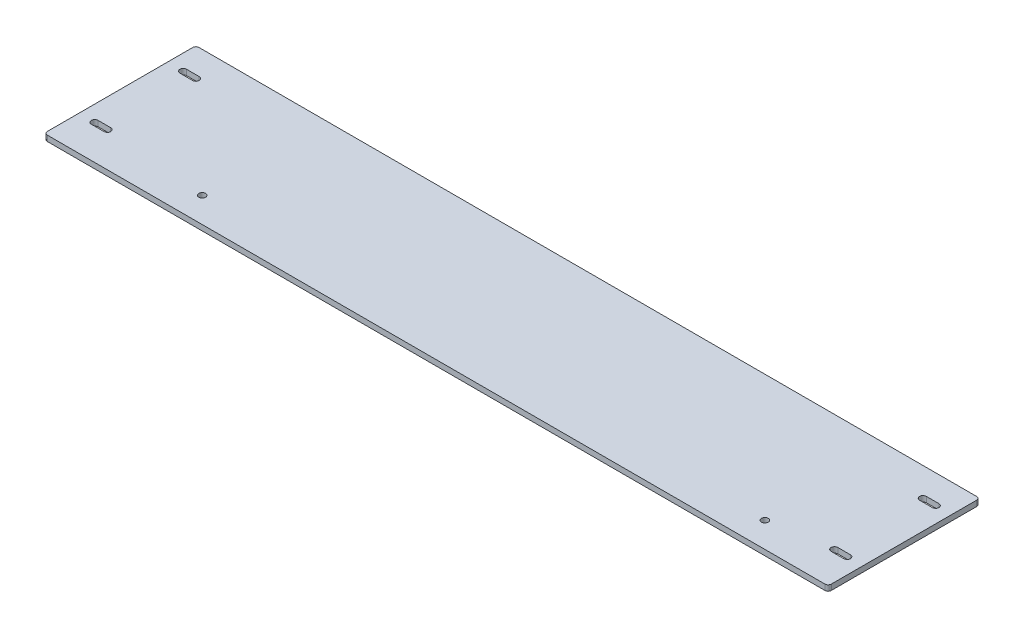
from build123d import *

# Parameters (mm, degrees)
SKETCH1_W           = 787.4
SKETCH1_H           = 152.4
BOSS_EXTRUDE1_DEPTH = 5.588
FILLET1_R           = 3.175
SKETCH2_R           = 3.3782
CUT_EXTRUDE1_DEPTH  = 803.03225979


with BuildPart() as part:
    # Sketch1 → Boss-Extrude1 (new body)
    with BuildSketch(Plane(origin=(0, 0, 0), x_dir=(1, 0, 0), z_dir=(0, 1, 0))):
        with Locations((393.7, 76.2)):
            Rectangle(SKETCH1_W, SKETCH1_H)
        with BuildLine():
            Line((15.875, 38.3032), (28.575, 38.3032))
            ThreePointArc((28.575, 38.3032), (31.9532, 34.925), (28.575, 31.5468))
            Line((28.575, 31.5468), (15.875, 31.5468))
            ThreePointArc((15.875, 31.5468), (12.4968, 34.925), (15.875, 38.3032))
        make_face(mode=Mode.SUBTRACT)
        with BuildLine():
            Line((15.875, 127.2032), (28.575, 127.2032))
            ThreePointArc((28.575, 127.2032), (31.9532, 123.825), (28.575, 120.4468))
            Line((28.575, 120.4468), (15.875, 120.4468))
            ThreePointArc((15.875, 120.4468), (12.4968, 123.825), (15.875, 127.2032))
        make_face(mode=Mode.SUBTRACT)
        with BuildLine():
            Line((771.525, 120.4468), (758.825, 120.4468))
            ThreePointArc((758.825, 120.4468), (755.4468, 123.825), (758.825, 127.2032))
            Line((758.825, 127.2032), (771.525, 127.2032))
            ThreePointArc((771.525, 127.2032), (774.9032, 123.825), (771.525, 120.4468))
        make_face(mode=Mode.SUBTRACT)
        with BuildLine():
            Line((771.525, 31.5468), (758.825, 31.5468))
            ThreePointArc((758.825, 31.5468), (755.4468, 34.925), (758.825, 38.3032))
            Line((758.825, 38.3032), (771.525, 38.3032))
            ThreePointArc((771.525, 38.3032), (774.9032, 34.925), (771.525, 31.5468))
        make_face(mode=Mode.SUBTRACT)
    extrude(amount=BOSS_EXTRUDE1_DEPTH)

    # Fillet1
    fillet1_edges = [part.edges().sort_by_distance(p)[0] for p in [
        (0, 2.794, -152.4),
        (787.4, 2.794, -152.4),
        (787.4, 2.794, 0),
        (0, 2.794, 0),
    ]]
    fillet(fillet1_edges, radius=FILLET1_R)

    # Sketch2 → Cut-Extrude1 (cut, through all)
    with BuildSketch(Plane(origin=(0, 5.588, 0), x_dir=(1, 0, 0), z_dir=(0, 1, 0))):
        with Locations(Location((133.35, 25.4, 0), (0, 0, 270))):
            Circle(SKETCH2_R)
        with Locations(Location((698.5, 25.4, 0), (0, 0, 270))):
            Circle(SKETCH2_R)
    extrude(amount=-CUT_EXTRUDE1_DEPTH, mode=Mode.SUBTRACT)


solid = part.part
